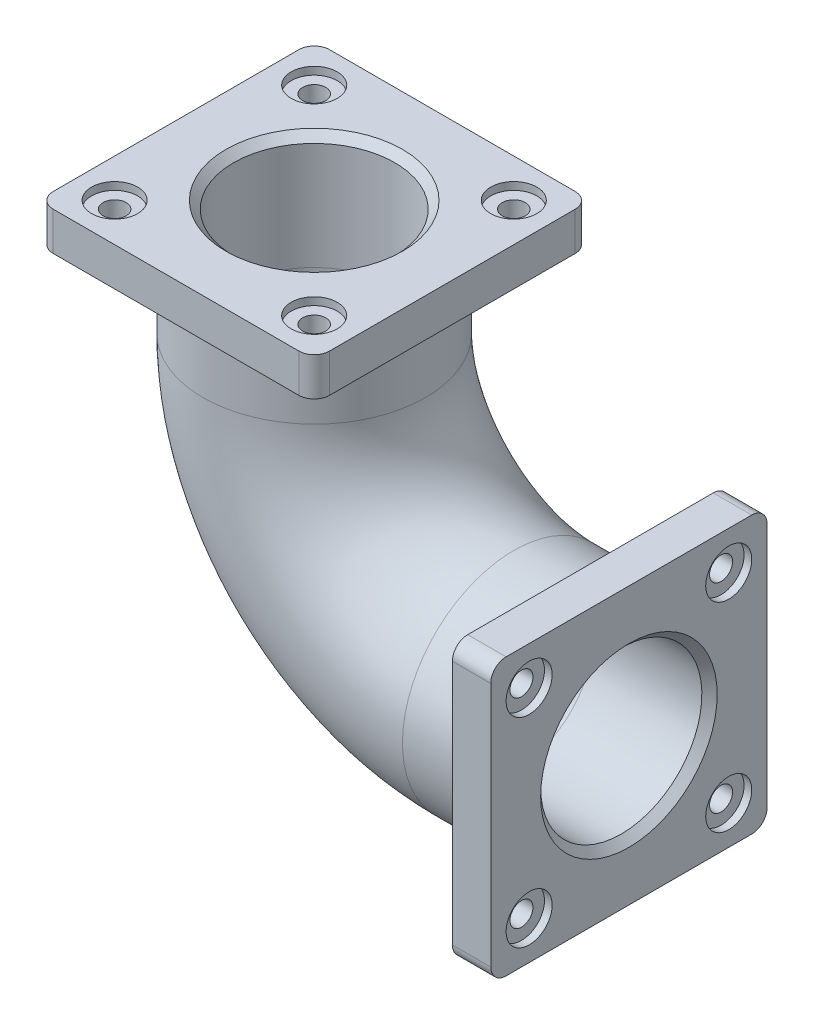
from build123d import *

# Parameters (mm, degrees)
SWEEP_THIN1_PROFILE_R   = 145
SWEEP_THIN1_PROFILE_R_2 = 105
BOSS_EXTRUDE1_START     = -50
SKETCH16_R              = 15
SKETCH16_R_2            = 145
BOSS_EXTRUDE1_DEPTH     = 50
SKETCH17_R              = 30
CUT_EXTRUDE1_DEPTH      = 10
CIRPATTERN1_COUNT       = 2
CIRPATTERN1_ANGLE       = 90
CHAMFER1_SIZE           = 10
FILLET1_R               = 10
CUT_EXTRUDE3_DEPTH      = 10
CIRPATTERN4_COUNT       = 2
CIRPATTERN4_ANGLE       = 90


with BuildPart() as part:
    # Sweep-Thin1: sweep along a path in Sketch1
    with BuildLine(Plane.XY) as sweep_thin1_path:
        Line((0, 410), (0, 260))
        ThreePointArc((0, 260), (76.152236891, 76.152236891), (260, 0))
        Line((260, 0), (410, 0))
    # Sweep-Thin1 profile (on start of the path) → Sweep-Thin1 (sweep)
    with BuildSketch(Plane(origin=(0, 410, 0), x_dir=(-1, 0, 0), z_dir=(0, -1, 0))):
        Circle(SWEEP_THIN1_PROFILE_R)
        Circle(SWEEP_THIN1_PROFILE_R_2, mode=Mode.SUBTRACT)
    sweep(path=sweep_thin1_path.line)

    # Sketch16 → Boss-Extrude1 (add)
    with BuildSketch(Plane(origin=(0, 410, 0), x_dir=(1, 0, 0), z_dir=(0, 1, 0)).offset(BOSS_EXTRUDE1_START)):
        with BuildLine():
            Line((-160, 180), (160, 180))
            ThreePointArc((160, 180), (174.142135624, 174.142135624), (180, 160))
            Line((180, 160), (180, -160))
            ThreePointArc((180, -160), (174.142135624, -174.142135624), (160, -180))
            Line((160, -180), (-160, -180))
            ThreePointArc((-160, -180), (-174.142135624, -174.142135624), (-180, -160))
            Line((-180, -160), (-180, 160))
            ThreePointArc((-180, 160), (-174.142135624, 174.142135624), (-160, 180))
        make_face()
        with Locations(Location((-130, -130, 0), (0, 0, 180))):
            Circle(SKETCH16_R, mode=Mode.SUBTRACT)
        with Locations(Location((130, -130, 0), (0, 0, 180))):
            Circle(SKETCH16_R, mode=Mode.SUBTRACT)
        with Locations(Location((-130, 130, 0), (0, 0, 180))):
            Circle(SKETCH16_R, mode=Mode.SUBTRACT)
        with Locations(Location((130, 130, 0), (0, 0, 180))):
            Circle(SKETCH16_R, mode=Mode.SUBTRACT)
        with Locations(Location((0, 0, 0), (0, 0, 180))):
            Circle(SKETCH16_R_2, mode=Mode.SUBTRACT)
    boss_extrude1 = extrude(amount=BOSS_EXTRUDE1_DEPTH)

    # Sketch17 → Cut-Extrude1 (cut)
    with BuildSketch(Plane(origin=(0, 410, 0), x_dir=(1, 0, 0), z_dir=(0, 1, 0))):
        with Locations(Location((-130, 130, 0), (0, 0, 180))):
            Circle(SKETCH17_R)
        with Locations(Location((130, 130, 0), (0, 0, 180))):
            Circle(SKETCH17_R)
        with Locations(Location((130, -130, 0), (0, 0, 180))):
            Circle(SKETCH17_R)
        with Locations(Location((-130, -130, 0), (0, 0, 180))):
            Circle(SKETCH17_R)
    cut_extrude1 = extrude(amount=-CUT_EXTRUDE1_DEPTH, mode=Mode.SUBTRACT)

    # CirPattern1: Boss-Extrude1, Cut-Extrude1 ×2 about axis
    cirpattern1_axis = Axis((0, 0, 0), (0, 0, -1))
    add([boss_extrude1.rotate(cirpattern1_axis, i * CIRPATTERN1_ANGLE / (CIRPATTERN1_COUNT - 1)) for i in range(1, CIRPATTERN1_COUNT)])
    add([cut_extrude1.rotate(cirpattern1_axis, i * CIRPATTERN1_ANGLE / (CIRPATTERN1_COUNT - 1)) for i in range(1, CIRPATTERN1_COUNT)], mode=Mode.SUBTRACT)

    # Chamfer1
    chamfer1_edges = [part.edges().sort_by_distance(p)[0] for p in [
        (105, 410, 0),
        (410, 105, 0),
    ]]
    chamfer(chamfer1_edges, length=CHAMFER1_SIZE)

    # Fillet1
    fillet1_edges = [part.edges().sort_by_distance(p)[0] for p in [
        (145, 360, 0),
        (360, 145, 0),
    ]]
    fillet(fillet1_edges, radius=FILLET1_R)

    # Sketch25 → Cut-Extrude3 (cut)
    with BuildSketch(Plane.XZ.offset(-360)):
        Polygon((-104.019237886, -130), (-117.009618943, -107.5), (-142.990381057, -107.5), (-155.980762114, -130), (-142.990381057, -152.5), (-117.009618943, -152.5), align=None)
        Polygon((104.019237886, 130), (117.009618943, 107.5), (142.990381057, 107.5), (155.980762114, 130), (142.990381057, 152.5), (117.009618943, 152.5), align=None)
        Polygon((117.009618943, -107.5), (104.019237886, -130), (117.009618943, -152.5), (142.990381057, -152.5), (155.980762114, -130), (142.990381057, -107.5), align=None)
        Polygon((-142.990381057, 152.5), (-155.980762114, 130), (-142.990381057, 107.5), (-117.009618943, 107.5), (-104.019237886, 130), (-117.009618943, 152.5), align=None)
    cut_extrude3 = extrude(amount=-CUT_EXTRUDE3_DEPTH, mode=Mode.SUBTRACT)

    # CirPattern4: Cut-Extrude3 ×2 about axis
    cirpattern4_axis = Axis((0, 0, 0), (0, 0, -1))
    for i in range(1, CIRPATTERN4_COUNT):
        add(cut_extrude3.rotate(cirpattern4_axis, i * CIRPATTERN4_ANGLE / (CIRPATTERN4_COUNT - 1)), mode=Mode.SUBTRACT)


solid = part.part
